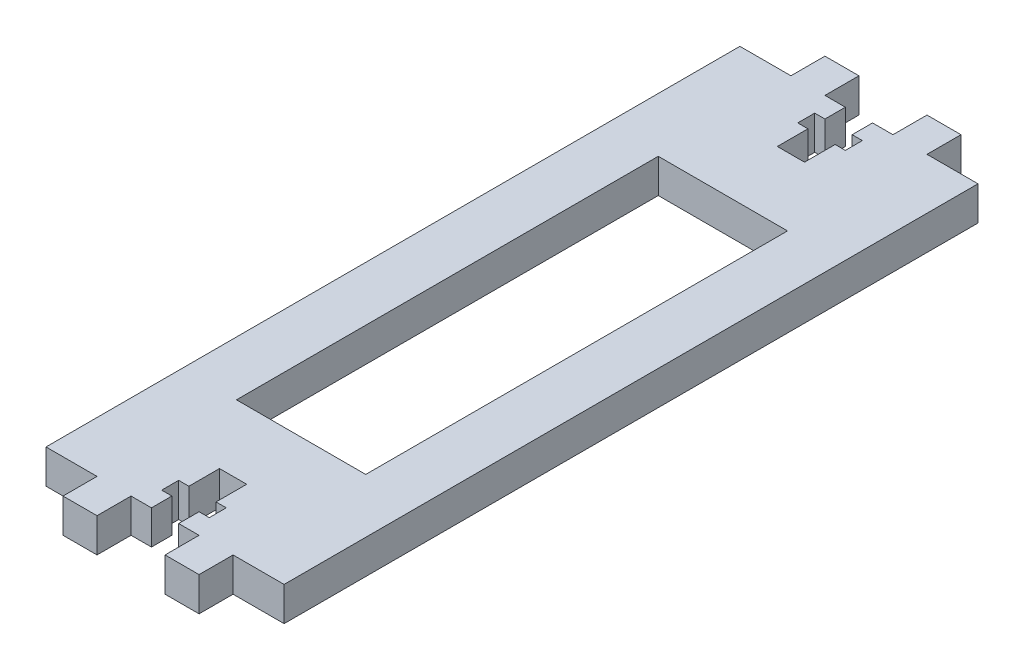
from build123d import *

# Parameters (mm, degrees)
SKETCH1_W           = 19
SKETCH1_H           = 62
BOSS_EXTRUDE1_DEPTH = 5


with BuildPart() as part:
    # Sketch1 → Boss-Extrude1 (new body)
    with BuildSketch(Plane(origin=(0, 0, 0), x_dir=(1, 0, 0), z_dir=(0, 1, 0))):
        Polygon((-1.543955144, 19.039548023), (-1.543955144, -0.960451977), (5.956044856, -0.960451977), (5.956044856, -5.960451977), (10.956044856, -5.960451977), (10.956044856, -0.960451977), (13.956044856, -0.960451977), (13.956044856, 2.039548023), (12.456044856, 2.039548023), (12.456044856, 4.539548023), (13.956044856, 4.539548023), (13.956044856, 9.039548023), (17.956044856, 9.039548023), (17.956044856, 4.539548023), (19.456044856, 4.539548023), (19.456044856, 2.039548023), (17.956044856, 2.039548023), (17.956044856, -0.960451977), (20.956044856, -0.960451977), (20.956044856, -5.960451977), (25.956044856, -5.960451977), (25.956044856, -0.960451977), (33.456044856, -0.960451977), (33.456044856, 19.039548023), (33.456044856, 81.039548023), (33.456044856, 101.039548023), (25.956044856, 101.039548023), (25.956044856, 106.039548023), (20.956044856, 106.039548023), (20.956044856, 101.039548023), (17.956044856, 101.039548023), (17.956044856, 98.039548023), (19.456044856, 98.039548023), (19.456044856, 95.539548023), (17.956044856, 95.539548023), (17.956044856, 91.039548023), (13.956044856, 91.039548023), (13.956044856, 95.539548023), (12.456044856, 95.539548023), (12.456044856, 98.039548023), (13.956044856, 98.039548023), (13.956044856, 101.039548023), (10.956044856, 101.039548023), (10.956044856, 106.039548023), (5.956044856, 106.039548023), (5.956044856, 101.039548023), (-1.543955144, 101.039548023), (-1.543955144, 81.039548023), align=None)
        with Locations((15.956044856, 50.039548023)):
            Rectangle(SKETCH1_W, SKETCH1_H, mode=Mode.SUBTRACT)
    extrude(amount=BOSS_EXTRUDE1_DEPTH)


solid = part.part
